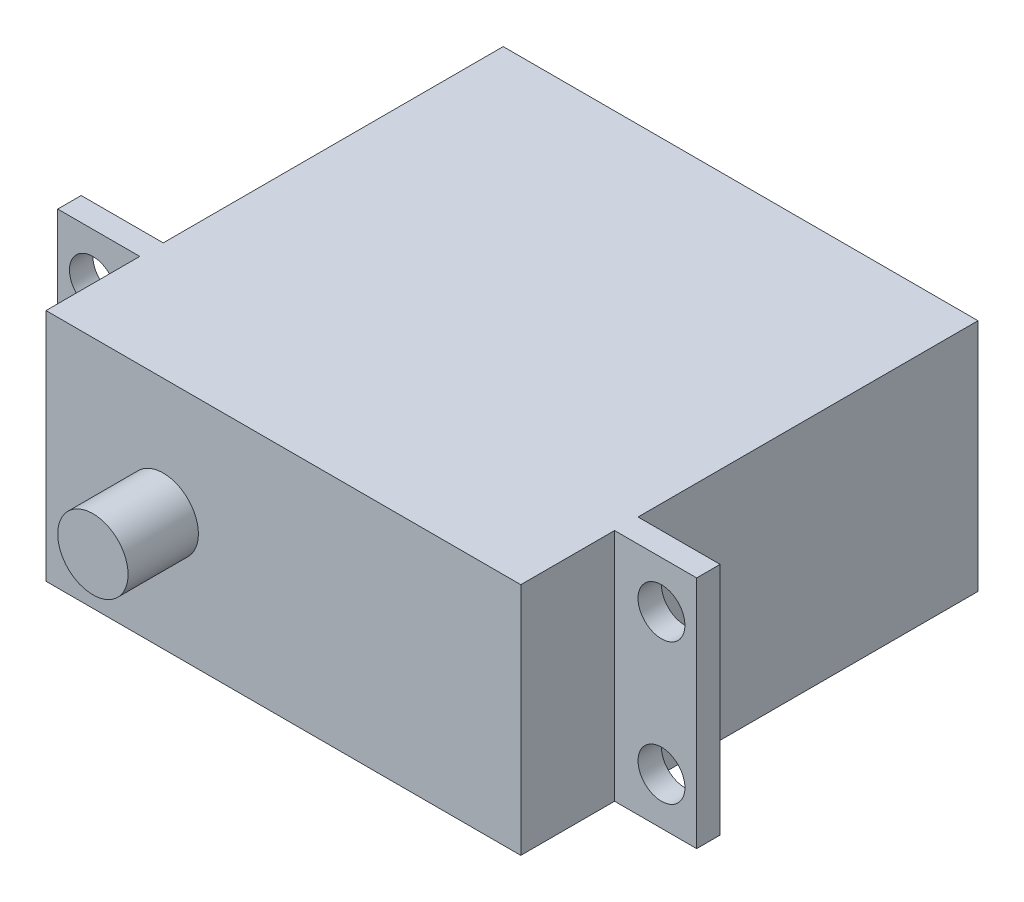
from build123d import *

# Parameters (mm, degrees)
SKETCH1_W           = 40.5
SKETCH1_H           = 20
BOSS_EXTRUDE1_DEPTH = 39
SKETCH2_R           = 3
BOSS_EXTRUDE2_DEPTH = 6
SKETCH3_W           = 2
SKETCH3_H           = 20
BOSS_EXTRUDE3_DEPTH = 7
SKETCH4_R           = 2
CUT_EXTRUDE1_DEPTH  = 7


with BuildPart() as part:
    # Sketch1 → Boss-Extrude1 (new body)
    with BuildSketch(Plane.XY):
        Rectangle(SKETCH1_W, SKETCH1_H)
    extrude(amount=BOSS_EXTRUDE1_DEPTH)

    # Sketch2 → Boss-Extrude2 (add)
    with BuildSketch(Plane.XY.offset(39)):
        with Locations((-10.25, 0)):
            Circle(SKETCH2_R)
    extrude(amount=BOSS_EXTRUDE2_DEPTH)

    # Sketch3 → Boss-Extrude3 (add)
    with BuildSketch(Plane.ZY.offset(20.25)):
        with Locations((30, 0)):
            Rectangle(SKETCH3_W, SKETCH3_H)
    boss_extrude3 = extrude(amount=BOSS_EXTRUDE3_DEPTH)

    # Sketch4 → Cut-Extrude1 (cut)
    with BuildSketch(Plane.XY.offset(31)):
        with Locations((-24.25, 6)):
            Circle(SKETCH4_R)
        with Locations(Location((-24.25, -6, 0), (0, 0, 270))):
            Circle(SKETCH4_R)
    cut_extrude1 = extrude(amount=-CUT_EXTRUDE1_DEPTH, mode=Mode.SUBTRACT)

    # Mirror1: Boss-Extrude3, Cut-Extrude1 across plane
    add(boss_extrude3.mirror(Plane(origin=(0, 0, 0), x_dir=(0, 0, 1), z_dir=(1, 0, 0))))
    add(cut_extrude1.mirror(Plane(origin=(0, 0, 0), x_dir=(0, 0, 1), z_dir=(1, 0, 0))), mode=Mode.SUBTRACT)


solid = part.part
